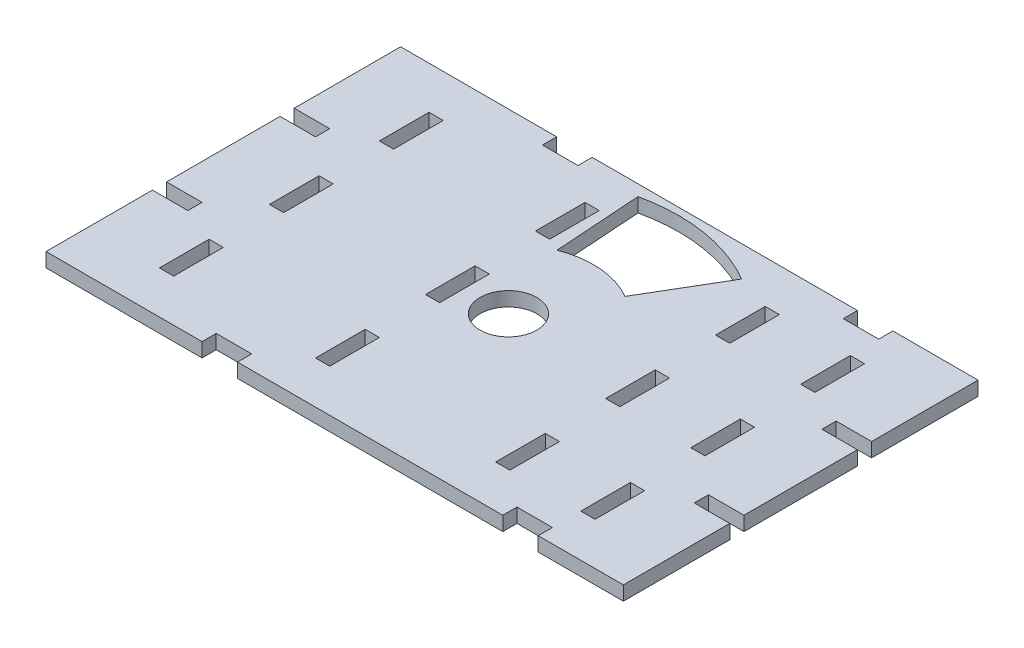
from build123d import *

# Parameters (mm, degrees)
SKETCH2_W           = 100
SKETCH2_H           = 50
SKETCH2_R           = 4
BOSS_EXTRUDE1_DEPTH = 2
SKETCH5_W           = 2
SKETCH5_H           = 7
CUT_EXTRUDE3_DEPTH  = 2
CUT_EXTRUDE6_DEPTH  = 2
SKETCH11_W          = 5
SKETCH11_H          = 2
CUT_EXTRUDE7_DEPTH  = 2
SKETCH12_W          = 9.8
SKETCH12_H          = 50
SKETCH12_W_2        = 8.8
CUT_EXTRUDE8_DEPTH  = 6
SKETCH13_W          = 2
SKETCH13_H          = 7
SKETCH13_W_2        = 5
SKETCH13_H_2        = 2
CUT_EXTRUDE10_DEPTH = 6


with BuildPart() as part:
    # Sketch2 → Boss-Extrude1 (new body)
    with BuildSketch(Plane(origin=(0, 0, 0), x_dir=(1, 0, 0), z_dir=(0, 1, 0))):
        Rectangle(SKETCH2_W, SKETCH2_H)
        with Locations(Location((0, 0, 0), (0, 0, 270))):
            Circle(SKETCH2_R, mode=Mode.SUBTRACT)
    extrude(amount=BOSS_EXTRUDE1_DEPTH)

    # Sketch5 → Cut-Extrude3 (cut)
    with BuildSketch(Plane(origin=(0, 0, 0), x_dir=(-1, 0, 0), z_dir=(0, -1, 0))):
        with Locations((-18.2, -15.5)):
            Rectangle(SKETCH5_W, SKETCH5_H)
        with Locations((-18.2, 0)):
            Rectangle(SKETCH5_W, SKETCH5_H)
        with Locations((-18.2, 15.5)):
            Rectangle(SKETCH5_W, SKETCH5_H)
        with Locations((7.2, 15.5)):
            Rectangle(SKETCH5_W, SKETCH5_H)
        with Locations((7.2, 0)):
            Rectangle(SKETCH5_W, SKETCH5_H)
        with Locations((7.2, -15.5)):
            Rectangle(SKETCH5_W, SKETCH5_H)
    extrude(amount=-CUT_EXTRUDE3_DEPTH, mode=Mode.SUBTRACT)

    # Sketch10 → Cut-Extrude6 (cut)
    with BuildSketch(Plane(origin=(0, 2, 0), x_dir=(1, 0, 0), z_dir=(0, 1, 0))):
        with BuildLine():
            ThreePointArc((-5.171573663, 23.436186248), (3.772267489, 23.701687661), (12.191771414, 20.672704462))
            Line((12.191771414, 20.672704462), (6.095885707, 10.336352231))
            ThreePointArc((6.095885707, 10.336352231), (0.977437683, 11.960126069), (-4.336736478, 11.188955122))
            Line((-4.336736478, 11.188955122), (-5.171573663, 23.436186248))
        make_face()
    extrude(amount=-CUT_EXTRUDE6_DEPTH, mode=Mode.SUBTRACT)

    # Sketch11 → Cut-Extrude7 (cut)
    with BuildSketch(Plane(origin=(0, 2, 0), x_dir=(1, 0, 0), z_dir=(0, 1, 0))):
        with Locations((-15.7, -24)):
            Rectangle(SKETCH11_W, SKETCH11_H)
        with Locations((26.7, -24)):
            Rectangle(SKETCH11_W, SKETCH11_H)
        with Locations((26.7, 24)):
            Rectangle(SKETCH11_W, SKETCH11_H)
        with Locations((-15.7, 24)):
            Rectangle(SKETCH11_W, SKETCH11_H)
    extrude(amount=-CUT_EXTRUDE7_DEPTH, mode=Mode.SUBTRACT)

    # Sketch12 → Cut-Extrude8 (cut)
    with BuildSketch(Plane(origin=(0, 2, 0), x_dir=(1, 0, 0), z_dir=(0, 1, 0))):
        with Locations((-45.1, 0)):
            Rectangle(SKETCH12_W, SKETCH12_H)
        with Locations((45.6, 0)):
            Rectangle(SKETCH12_W_2, SKETCH12_H)
    extrude(amount=-CUT_EXTRUDE8_DEPTH, mode=Mode.SUBTRACT)

    # Sketch13 → Cut-Extrude10 (cut)
    with BuildSketch(Plane(origin=(0, 2, 0), x_dir=(1, 0, 0), z_dir=(0, 1, 0))):
        with Locations((-29.2, 15.5)):
            Rectangle(SKETCH13_W, SKETCH13_H)
        with Locations((-29.2, 0)):
            Rectangle(SKETCH13_W, SKETCH13_H)
        with Locations((-29.2, -15.5)):
            Rectangle(SKETCH13_W, SKETCH13_H)
        with Locations((30.2, 15.5)):
            Rectangle(SKETCH13_W, SKETCH13_H)
        with Locations((30.2, 0)):
            Rectangle(SKETCH13_W, SKETCH13_H)
        with Locations((30.2, -15.5)):
            Rectangle(SKETCH13_W, SKETCH13_H)
        with Locations((-37.7, 9)):
            Rectangle(SKETCH13_W_2, SKETCH13_H_2)
        with Locations((-37.7, -9)):
            Rectangle(SKETCH13_W_2, SKETCH13_H_2)
        with Locations((38.7, 9)):
            Rectangle(SKETCH13_W_2, SKETCH13_H_2)
        with Locations((38.7, -9)):
            Rectangle(SKETCH13_W_2, SKETCH13_H_2)
    extrude(amount=-CUT_EXTRUDE10_DEPTH, mode=Mode.SUBTRACT)


solid = part.part
